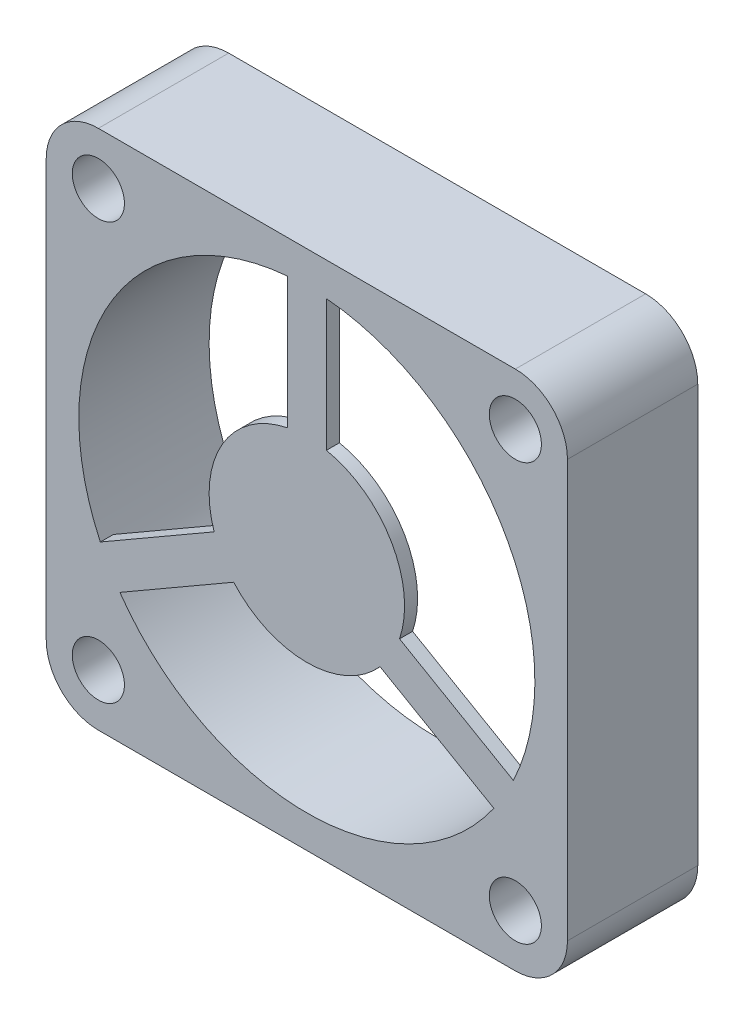
from build123d import *

# Parameters (mm, degrees)
SKETCH_1_R      = 17.5
SKETCH_1_R_2    = 2
EXTRUDE_1_DEPTH = 10
EXTRUDE_START   = -1
EXTRUDE_2_DEPTH = 1


with BuildPart() as part:
    # 草图1 → 凸台-拉伸1 (new body)
    with BuildSketch(Plane.XY):
        with BuildLine():
            Line((-16, -20), (16, -20))
            ThreePointArc((16, -20), (18.828427125, -18.828427125), (20, -16))
            Line((20, -16), (20, 16))
            ThreePointArc((20, 16), (18.828427125, 18.828427125), (16, 20))
            Line((16, 20), (-16, 20))
            ThreePointArc((-16, 20), (-18.828427125, 18.828427125), (-20, 16))
            Line((-20, 16), (-20, -16))
            ThreePointArc((-20, -16), (-18.828427125, -18.828427125), (-16, -20))
        make_face()
        Circle(SKETCH_1_R, mode=Mode.SUBTRACT)
        with Locations((-16, 16)):
            Circle(SKETCH_1_R_2, mode=Mode.SUBTRACT)
        with Locations((16, 16)):
            Circle(SKETCH_1_R_2, mode=Mode.SUBTRACT)
        with Locations((16, -16)):
            Circle(SKETCH_1_R_2, mode=Mode.SUBTRACT)
        with Locations((-16, -16)):
            Circle(SKETCH_1_R_2, mode=Mode.SUBTRACT)
    extrude(amount=EXTRUDE_1_DEPTH)

    # 草图2 → 凸台-拉伸2 (add)
    with BuildSketch(Plane.XY.offset(10).offset(EXTRUDE_START)):
        with BuildLine():
            Line((-1.5, 17.435595774), (-1.5, 7.348469228))
            ThreePointArc((-1.5, 7.348469228), (-6.495190528, 3.75), (-7.113961031, -2.375196508))
            Line((-7.113961031, -2.375196508), (-15.849668871, -7.418759781))
            ThreePointArc((-15.849668871, -7.418759781), (-15.155444566, -8.75), (-14.349668871, -10.016835993))
            Line((-14.349668871, -10.016835993), (-5.613961031, -4.97327272))
            ThreePointArc((-5.613961031, -4.97327272), (0, -7.5), (5.613961031, -4.97327272))
            Line((5.613961031, -4.97327272), (14.349668871, -10.016835993))
            ThreePointArc((14.349668871, -10.016835993), (15.155444566, -8.75), (15.849668871, -7.418759781))
            Line((15.849668871, -7.418759781), (7.113961031, -2.375196508))
            ThreePointArc((7.113961031, -2.375196508), (6.495190528, 3.75), (1.5, 7.348469228))
            Line((1.5, 7.348469228), (1.5, 17.435595774))
            ThreePointArc((1.5, 17.435595774), (0, 17.5), (-1.5, 17.435595774))
        make_face()
    extrude(amount=EXTRUDE_2_DEPTH)


solid = part.part
